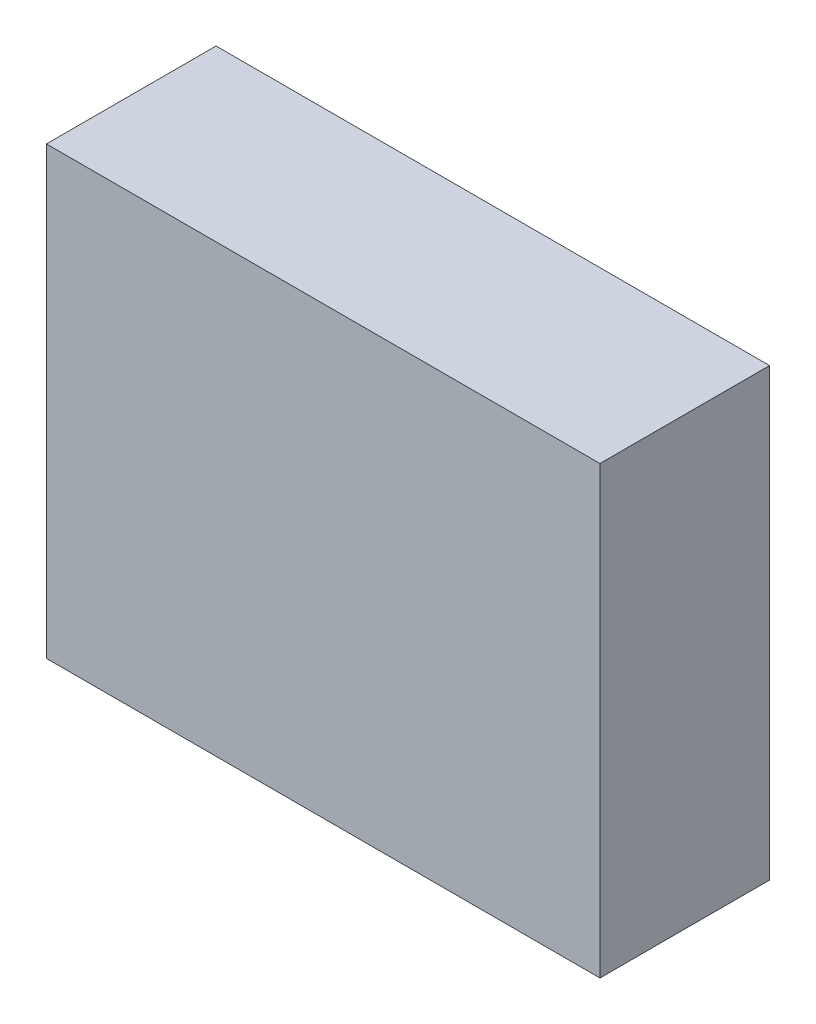
from build123d import *

# Parameters (mm, degrees)
ESQUISSE1_W             = 3.2635
ESQUISSE1_H             = 2.627
COMPONENT_OUTLINE_DEPTH = 1


with BuildPart() as part:
    # Esquisse1 → Component_Outline (new body)
    with BuildSketch(Plane.XY):
        with Locations((-0.03175, 0)):
            Rectangle(ESQUISSE1_W, ESQUISSE1_H)
    extrude(amount=COMPONENT_OUTLINE_DEPTH)


solid = part.part
